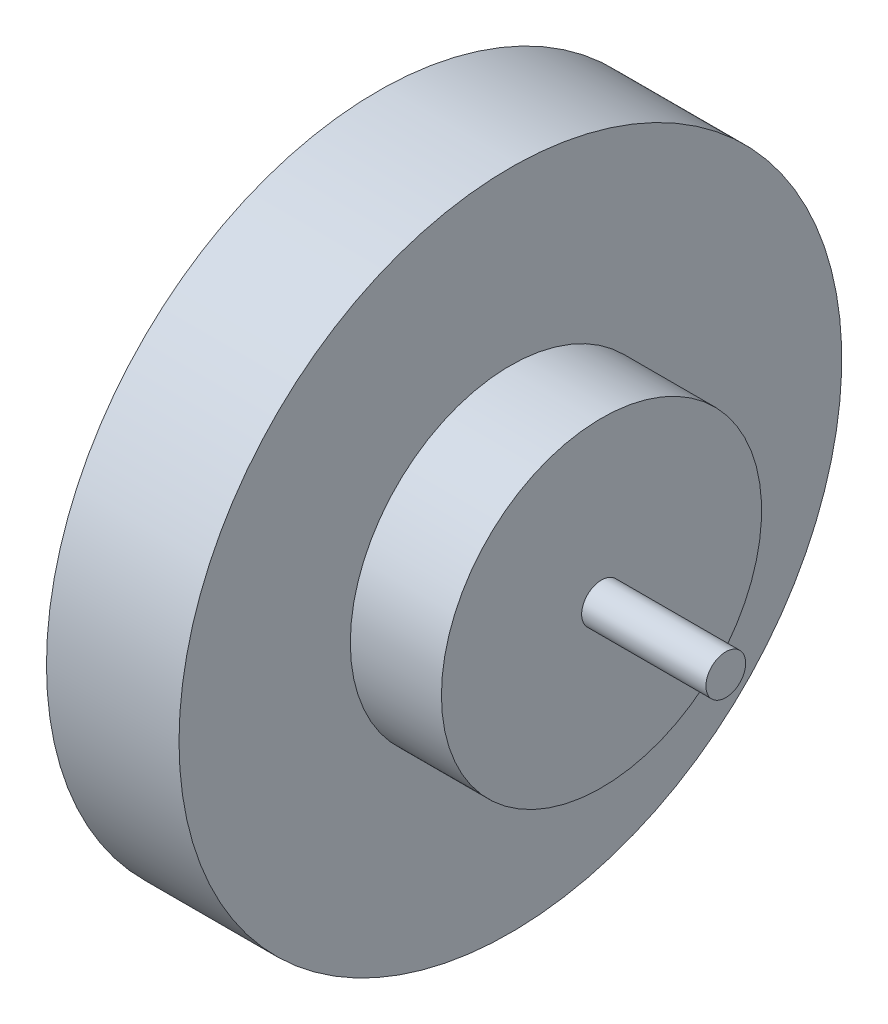
from build123d import *


with BuildPart() as part:
    # 草图1 → 旋转1 (revolve)
    with BuildSketch(Plane.XY, mode=Mode.PRIVATE) as revolve_1_sk:
        Polygon((0, 0), (0, 100), (20, 100), (20, 48.308684326), (47.5, 48.308684326), (47.5, 6), (85, 6), (85, 0), align=None)
    revolve_1 = revolve(revolve_1_sk.sketch.rotate(Axis((-1219.943710548, 0, 0), (1, 0, 0)), 90), axis=Axis((-1219.943710548, 0, 0), (1, 0, 0)))

    # 镜向1: 旋转1 across plane
    add(revolve_1.mirror(Plane(origin=(0, 0, 0), x_dir=(0, 0, 1), z_dir=(1, 0, 0))))


solid = part.part
